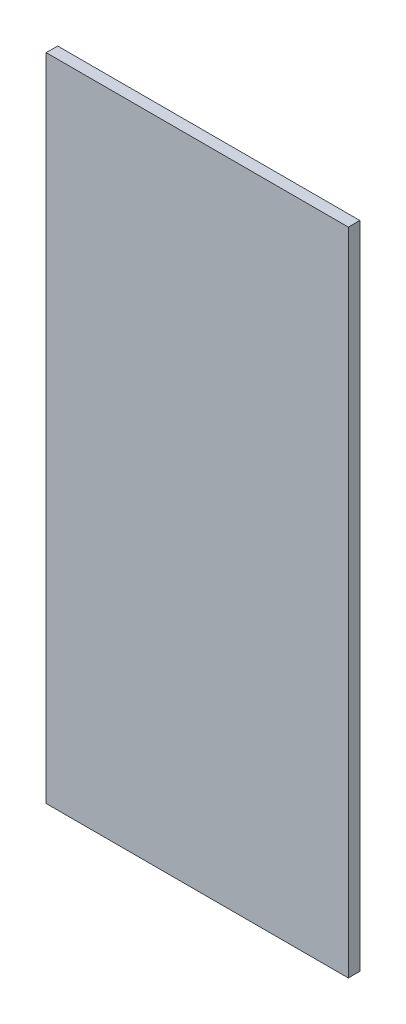
from build123d import *

# Parameters (mm, degrees)
SKETCH2_W           = 26.3
SKETCH2_H           = 56.6
BOSS_EXTRUDE1_DEPTH = 1


with BuildPart() as part:
    # Sketch2 → Boss-Extrude1 (new body)
    with BuildSketch(Plane.XY):
        Rectangle(SKETCH2_W, SKETCH2_H)
    extrude(amount=BOSS_EXTRUDE1_DEPTH)


solid = part.part
